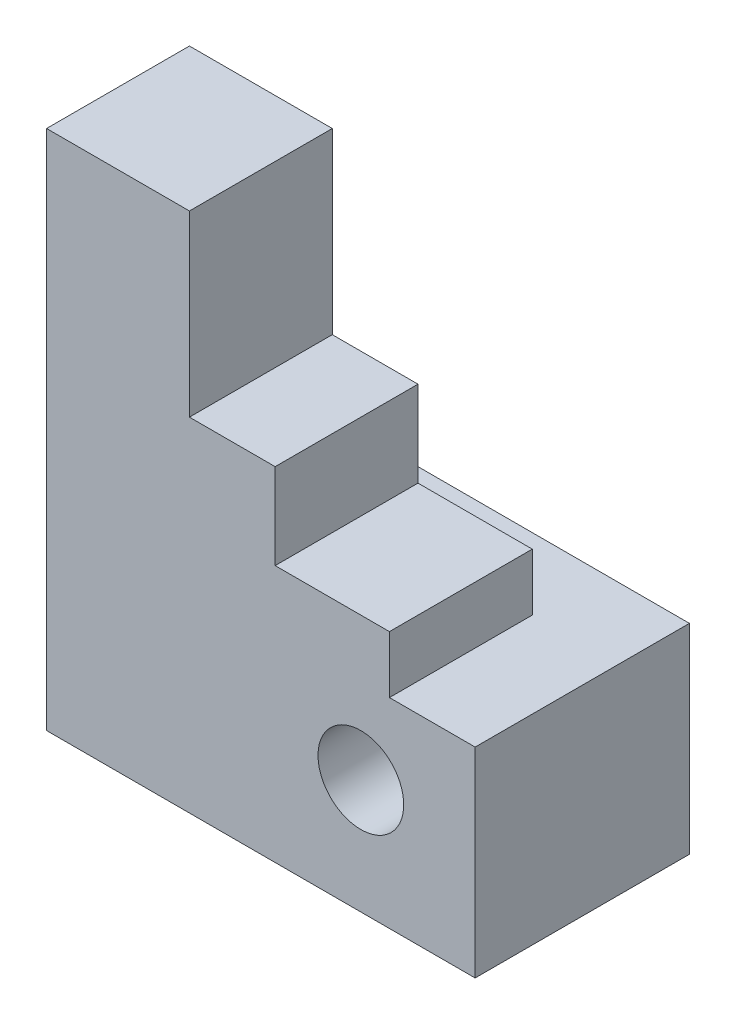
from build123d import *

# Parameters (mm, degrees)
SKETCH2_W           = 60
SKETCH2_H           = 30
BOSS_EXTRUDE1_DEPTH = 28
BOSS_EXTRUDE3_DEPTH = 20
SKETCH6_R           = 6
CUT_EXTRUDE7_DEPTH  = 60


with BuildPart() as part:
    # Sketch2 → Boss-Extrude1 (new body)
    with BuildSketch(Plane(origin=(0, 0, 0), x_dir=(1, 0, 0), z_dir=(0, 1, 0))):
        with Locations((30, 15)):
            Rectangle(SKETCH2_W, SKETCH2_H)
    extrude(amount=BOSS_EXTRUDE1_DEPTH)

    # Sketch3 → Boss-Extrude3 (add)
    with BuildSketch(Plane.XY):
        Polygon((0, 28), (0, 73), (20, 73), (20, 48), (32, 48), (32, 36), (48, 36), (48, 28), align=None)
    extrude(amount=-BOSS_EXTRUDE3_DEPTH)

    # Sketch6 → Cut-Extrude7 (cut)
    with BuildSketch(Plane(origin=(0, 0, -30), x_dir=(-1, 0, 0), z_dir=(0, 0, -1))):
        with Locations((-44, 16)):
            Circle(SKETCH6_R)
    extrude(amount=-CUT_EXTRUDE7_DEPTH, mode=Mode.SUBTRACT)


solid = part.part
